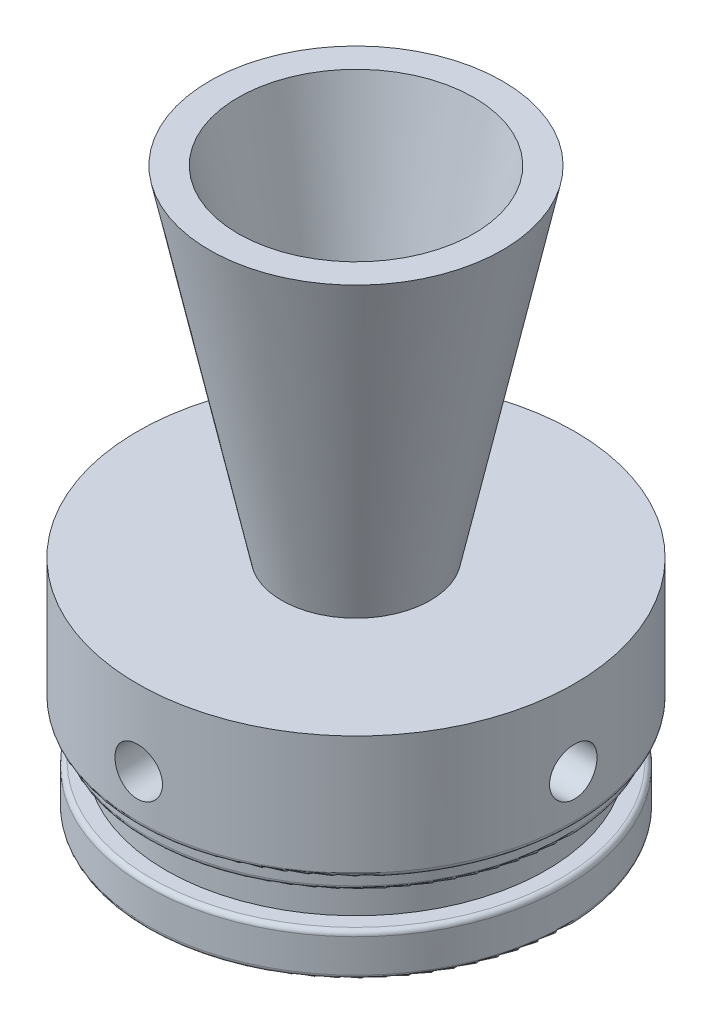
from build123d import *

# Parameters (mm, degrees)
FILLET_3_R          = 0.5
FILLET_4_R          = 0.5
SKETCH_4_R          = 2.5
CUT_EXTRUDE_1_DEPTH = 6
SKETCH_5_R          = 2.5
CUT_EXTRUDE_2_DEPTH = 6
CUT_EXTRUDE_START   = -6
SKETCH_6_R          = 2.5
CUT_EXTRUDE_3_DEPTH = 6
SKETCH_7_R          = 2.5
CUT_EXTRUDE_4_DEPTH = 6
FILLET_5_R          = 0.5
FILLET_6_R          = 0.5


with BuildPart() as part:
    # 스케치1 → 회전2 (revolve)
    with BuildSketch(Plane.XY, mode=Mode.PRIVATE) as revolve_2_sk:
        Polygon((4.605, 21.99), (20, 0), (22, 0), (22, 4.5), (20, 4.5), (20, 8), (22, 8.174977327), (22, 10), (23, 10), (23, 23), (7.819621563, 23), (15.41, 58.72), (12.41, 58.72), align=None)
    revolve(revolve_2_sk.sketch.rotate(Axis((0, 0, 0), (0, 1, 0)), 90), axis=Axis((0, 0, 0), (0, 1, 0)))

    # 필렛3
    fillet_3_edges = [part.edges().sort_by_distance(p)[0] for p in [
        (0, 8.174977327, 22),
    ]]
    fillet(fillet_3_edges, radius=FILLET_3_R)

    # 필렛4
    fillet_4_edges = [part.edges().sort_by_distance(p)[0] for p in [
        (0, 4.5, 22),
    ]]
    fillet(fillet_4_edges, radius=FILLET_4_R)

    # 스케치4 → 컷-돌출1 (cut)
    with BuildSketch(Plane.ZY.offset(23)):
        with Locations((0, 15)):
            Circle(SKETCH_4_R)
    extrude(amount=-CUT_EXTRUDE_1_DEPTH, mode=Mode.SUBTRACT)

    # 스케치5 → 컷-돌출2 (cut)
    with BuildSketch(Plane.XY.offset(23)):
        with Locations((0, 15)):
            Circle(SKETCH_5_R)
    extrude(amount=-CUT_EXTRUDE_2_DEPTH, mode=Mode.SUBTRACT)

    # 스케치6 → 컷-돌출3 (cut)
    with BuildSketch(Plane(origin=(23, 0, 0), x_dir=(0, 0, -1), z_dir=(1, 0, 0)).offset(CUT_EXTRUDE_START)):
        with Locations(Location((0, 15, 0), (0, 0, 180))):
            Circle(SKETCH_6_R)
    extrude(amount=CUT_EXTRUDE_3_DEPTH, mode=Mode.SUBTRACT)

    # 스케치7 → 컷-돌출4 (cut)
    with BuildSketch(Plane(origin=(0, 0, -23), x_dir=(-1, 0, 0), z_dir=(0, 0, -1)).offset(CUT_EXTRUDE_START)):
        with Locations(Location((0, 15, 0), (0, 0, 180))):
            Circle(SKETCH_7_R)
    extrude(amount=CUT_EXTRUDE_4_DEPTH, mode=Mode.SUBTRACT)

    # 필렛5
    fillet_5_edges = [part.edges().sort_by_distance(p)[0] for p in [
        (0, 0, 22),
    ]]
    fillet(fillet_5_edges, radius=FILLET_5_R)

    # 필렛6
    fillet_6_edges = [part.edges().sort_by_distance(p)[0] for p in [
        (0, 10, 23),
    ]]
    fillet(fillet_6_edges, radius=FILLET_6_R)


solid = part.part
